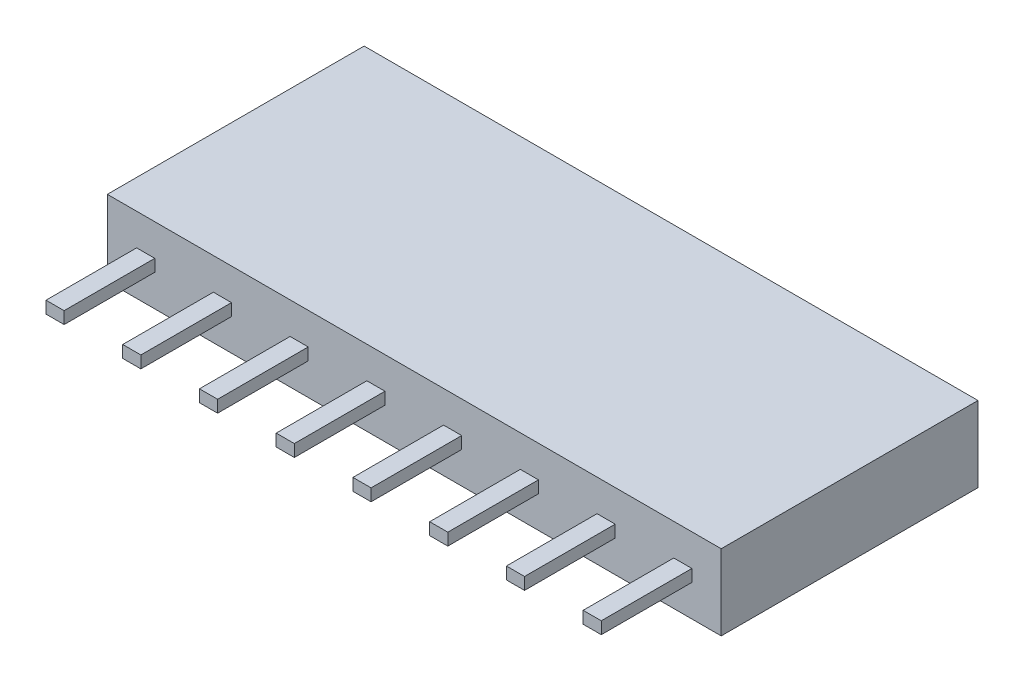
from build123d import *

# Parameters (mm, degrees)
SKETCH_1_W      = 20.32
SKETCH_1_H      = 8.5
EXTRUDE_1_DEPTH = 2.5
SKETCH_2_W      = 0.6
SKETCH_2_H      = 0.4
EXTRUDE_2_DEPTH = 3


with BuildPart() as part:
    # Эскиз1 → Бобышка-Вытянуть1 (new body)
    with BuildSketch(Plane(origin=(0, 0, 0), x_dir=(1, 0, 0), z_dir=(0, 1, 0))):
        Rectangle(SKETCH_1_W, SKETCH_1_H)
    extrude(amount=EXTRUDE_1_DEPTH)

    # Эскиз2 → Бобышка-Вытянуть2 (add)
    with BuildSketch(Plane.XY.offset(4.25)):
        with Locations((-6.35, 1.25)):
            Rectangle(SKETCH_2_W, SKETCH_2_H)
        with Locations((-8.89, 1.25)):
            Rectangle(SKETCH_2_W, SKETCH_2_H)
        with Locations((-3.81, 1.25)):
            Rectangle(SKETCH_2_W, SKETCH_2_H)
        with Locations((-1.27, 1.25)):
            Rectangle(SKETCH_2_W, SKETCH_2_H)
        with Locations((1.27, 1.25)):
            Rectangle(SKETCH_2_W, SKETCH_2_H)
        with Locations((3.81, 1.25)):
            Rectangle(SKETCH_2_W, SKETCH_2_H)
        with Locations((6.35, 1.25)):
            Rectangle(SKETCH_2_W, SKETCH_2_H)
        with Locations((8.89, 1.25)):
            Rectangle(SKETCH_2_W, SKETCH_2_H)
    extrude(amount=EXTRUDE_2_DEPTH)


solid = part.part
